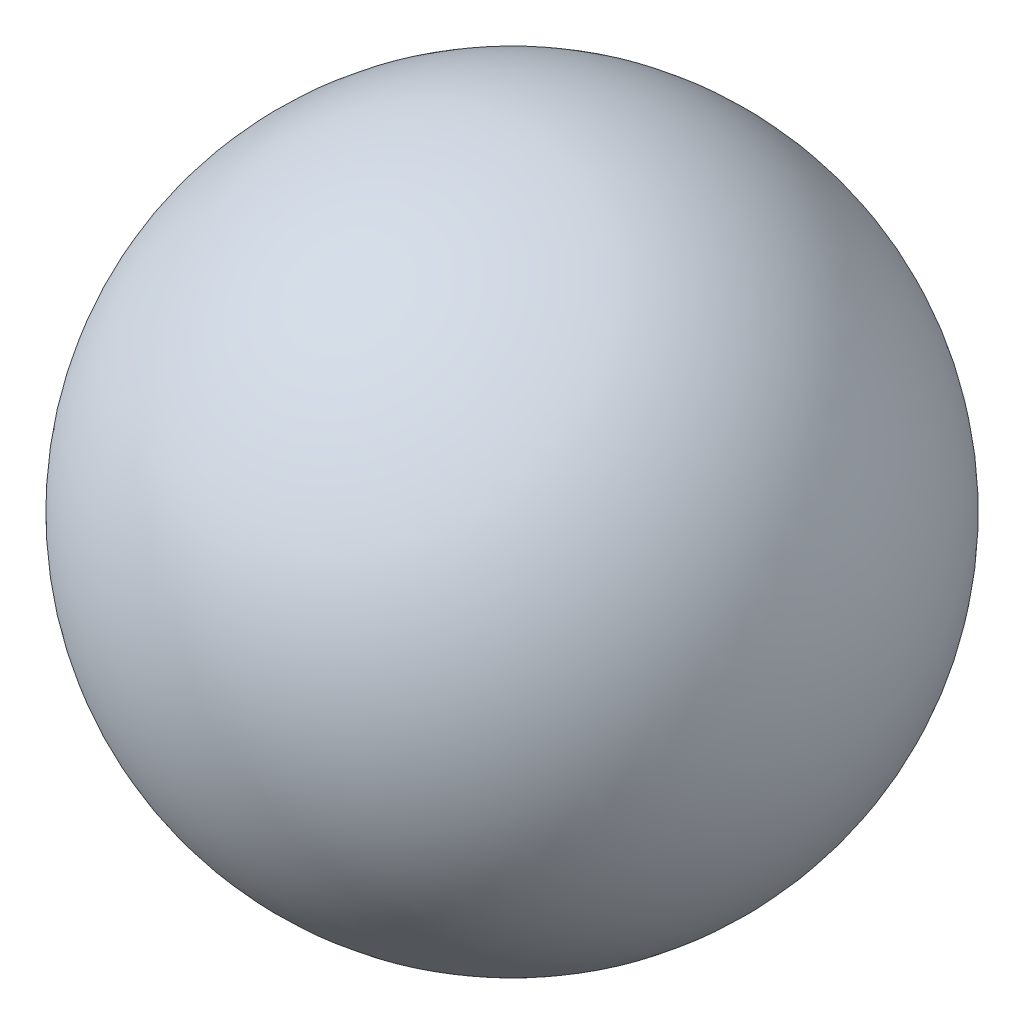
from build123d import *


with BuildPart() as part:
    # Sketch1 → Revolve1 (revolve)
    with BuildSketch(Plane.XY):
        with BuildLine():
            Line((0, 80), (0, 76))
            ThreePointArc((0, 76), (-76, 0), (0, -76))
            Line((0, -76), (0, -80))
            ThreePointArc((0, -80), (-80, 0), (0, 80))
        make_face()
    revolve(axis=Axis((0, 105.084210526, 0), (0, -1, 0)))


solid = part.part
